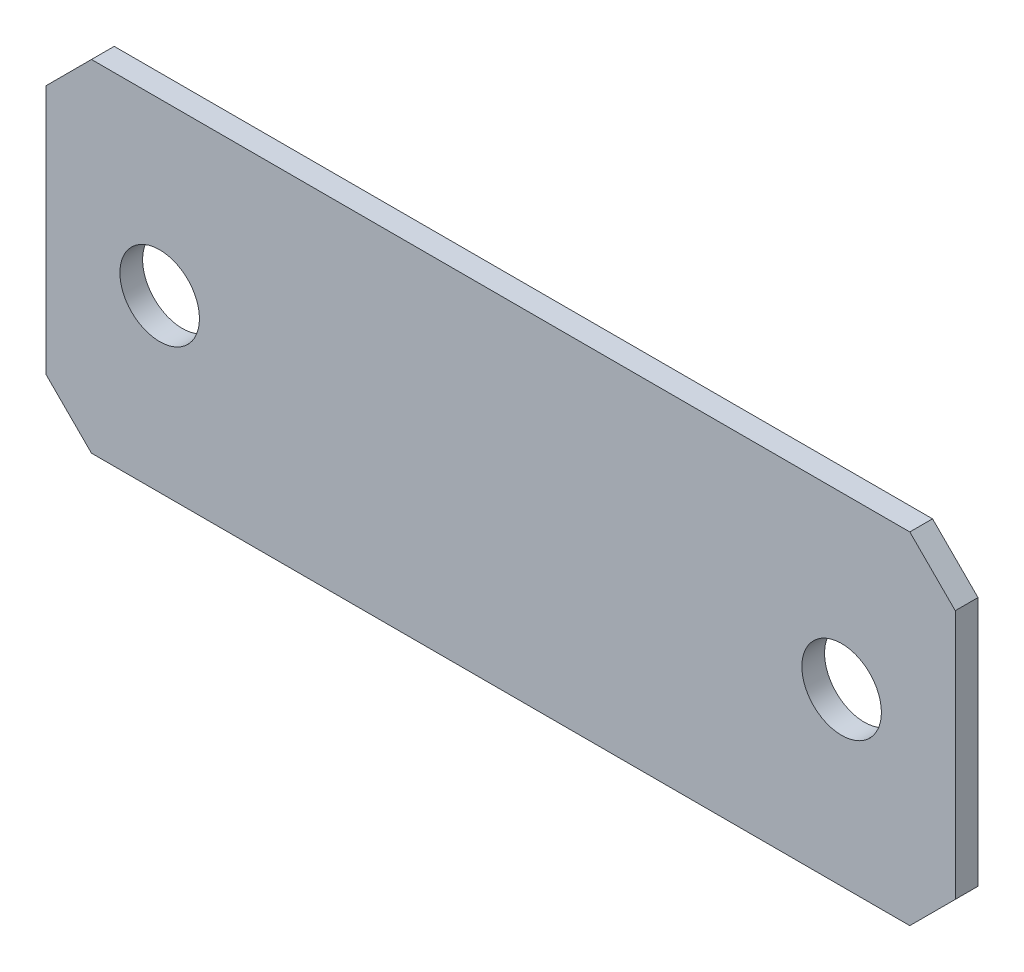
from build123d import *

# Parameters (mm, degrees)
SKIZZE1_W                       = 40
SKIZZE1_H                       = 15
SKIZZE1_R                       = 1.75
AUFSATZ_LINEAR_AUSTRAGEN1_DEPTH = 1
FASE1_SIZE                      = 2


with BuildPart() as part:
    # Skizze1 → Aufsatz-Linear austragen1 (new body)
    with BuildSketch(Plane.XY):
        Rectangle(SKIZZE1_W, SKIZZE1_H)
        with Locations((-15, 0)):
            Circle(SKIZZE1_R, mode=Mode.SUBTRACT)
        with Locations((15, 0)):
            Circle(SKIZZE1_R, mode=Mode.SUBTRACT)
    extrude(amount=AUFSATZ_LINEAR_AUSTRAGEN1_DEPTH)

    # Fase1
    fase1_edges = [part.edges().sort_by_distance(p)[0] for p in [
        (-20, 7.5, 0.5),
        (20, 7.5, 0.5),
        (20, -7.5, 0.5),
        (-20, -7.5, 0.5),
    ]]
    chamfer(fase1_edges, length=FASE1_SIZE)


solid = part.part
